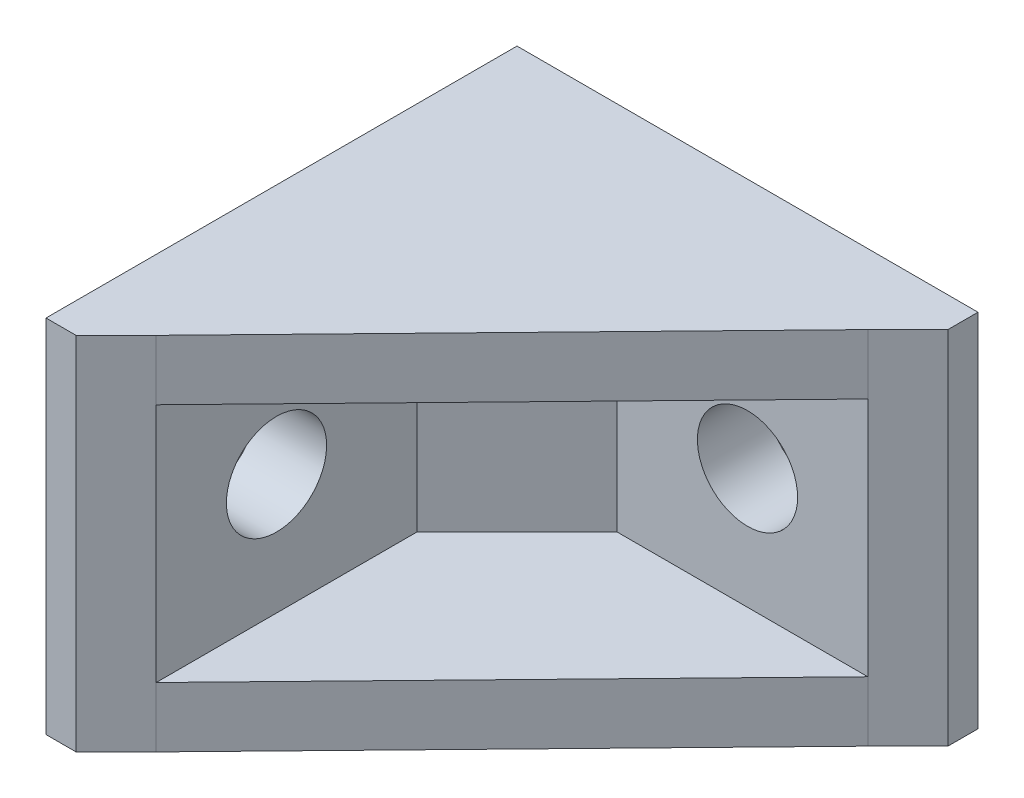
from build123d import *

# Parameters (mm, degrees)
ESQUISSE1_W             = 23
ESQUISSE1_H             = 18
BOSS_EXTRU_1_DEPTH      = 3.5
ESQUISSE2_W             = 3.5
ESQUISSE2_H             = 18
BOSS_EXTRU_2_DEPTH      = 20
ESQUISSE3_R             = 2.5
ENL_V_MAT_EXTRU_1_DEPTH = 20
ESQUISSE4_R             = 2.5
ENL_V_MAT_EXTRU_2_DEPTH = 20
CHANFREIN1_SIZE         = 5
CHANFREIN2_SIZE         = 2
BOSS_EXTRU_3_DEPTH      = 3
BOSS_EXTRU_4_DEPTH      = 3


with BuildPart() as part:
    # Esquisse1 → Boss.-Extru.1 (new body)
    with BuildSketch(Plane.XY):
        with Locations((0.836143498, 5.76)):
            Rectangle(ESQUISSE1_W, ESQUISSE1_H)
    extrude(amount=BOSS_EXTRU_1_DEPTH)

    # Esquisse2 → Boss.-Extru.2 (add)
    with BuildSketch(Plane.XY.offset(3.5)):
        with Locations((-8.913856502, 5.76)):
            Rectangle(ESQUISSE2_W, ESQUISSE2_H)
    extrude(amount=BOSS_EXTRU_2_DEPTH)

    # Esquisse3 → Enlèv. mat.-Extru.1 (cut)
    with BuildSketch(Plane.XY.offset(3.5)):
        with Locations((4.336143498, 5.76)):
            Circle(ESQUISSE3_R)
    extrude(amount=-ENL_V_MAT_EXTRU_1_DEPTH, mode=Mode.SUBTRACT)

    # Esquisse4 → Enlèv. mat.-Extru.2 (cut)
    with BuildSketch(Plane(origin=(-7.163856502, 0, 0), x_dir=(0, 0, -1), z_dir=(1, 0, 0))):
        with Locations(Location((-15.5, 5.76, 0), (0, 0, 90))):
            Circle(ESQUISSE4_R)
    extrude(amount=-ENL_V_MAT_EXTRU_2_DEPTH, mode=Mode.SUBTRACT)

    # Chanfrein1
    chanfrein1_edges = [part.edges().sort_by_distance(p)[0] for p in [
        (-7.163856502, 5.76, 3.5),
    ]]
    chamfer(chanfrein1_edges, length=CHANFREIN1_SIZE)

    # Chanfrein2
    chanfrein2_edges = [part.edges().sort_by_distance(p)[0] for p in [
        (12.336143498, 5.76, 3.5),
        (-7.163856502, 5.76, 23.5),
    ]]
    chamfer(chanfrein2_edges, length=CHANFREIN2_SIZE)

    # Esquisse5 → Boss.-Extru.3 (add)
    with BuildSketch(Plane(origin=(0, 14.76, 0), x_dir=(1, 0, 0), z_dir=(0, 1, 0))):
        Polygon((10.336143498, -3.5), (-7.163856502, -21.5), (-7.163856502, -8.5), (-2.163856502, -3.5), align=None)
    extrude(amount=-BOSS_EXTRU_3_DEPTH)

    # Esquisse6 → Boss.-Extru.4 (add)
    with BuildSketch(Plane(origin=(0, -3.24, 0), x_dir=(-1, 0, 0), z_dir=(0, -1, 0))):
        Polygon((7.163856502, -21.5), (-10.336143498, -3.5), (2.163856502, -3.5), (7.163856502, -8.5), align=None)
    extrude(amount=-BOSS_EXTRU_4_DEPTH)


solid = part.part
